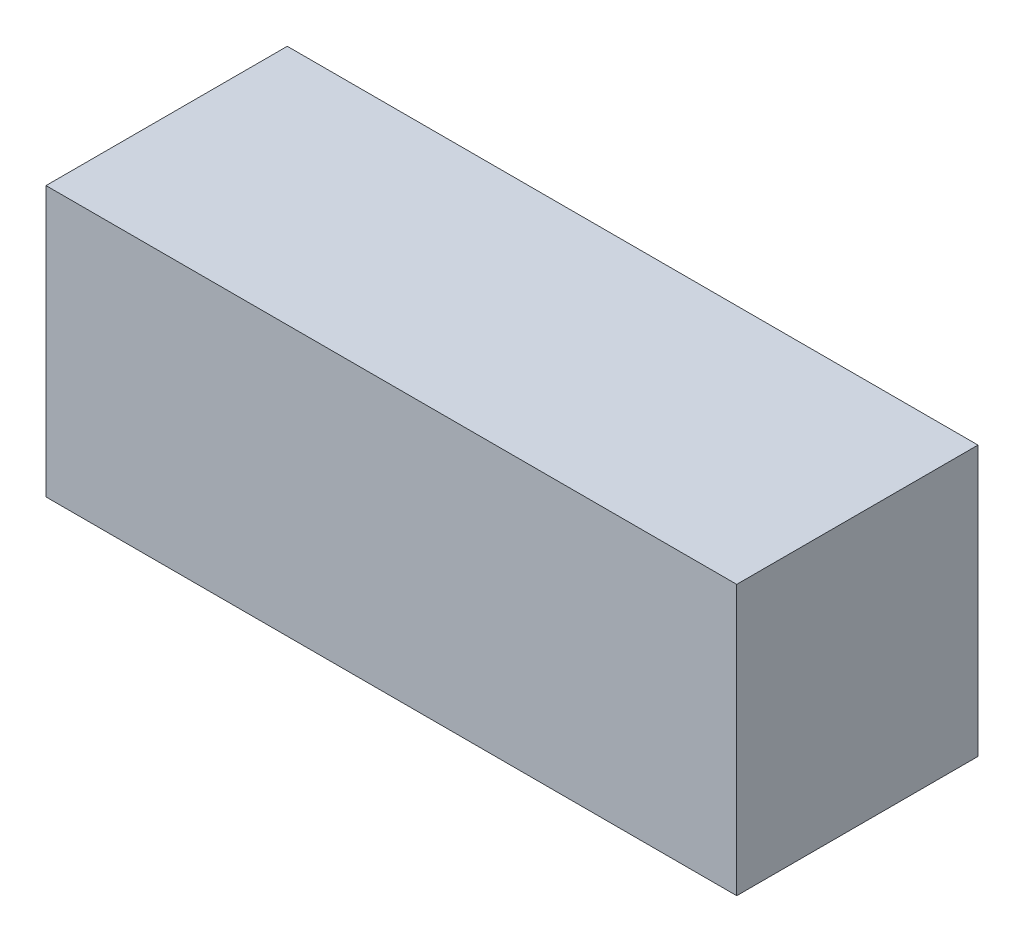
from build123d import *

# Parameters (mm, degrees)
SKETCH1_W           = 146
SKETCH1_H           = 51
BOSS_EXTRUDE1_DEPTH = 57


with BuildPart() as part:
    # Sketch1 → Boss-Extrude1 (new body)
    with BuildSketch(Plane(origin=(0, 0, 0), x_dir=(1, 0, 0), z_dir=(0, 1, 0))):
        with Locations((73, 25.5)):
            Rectangle(SKETCH1_W, SKETCH1_H)
    extrude(amount=BOSS_EXTRUDE1_DEPTH)


solid = part.part
